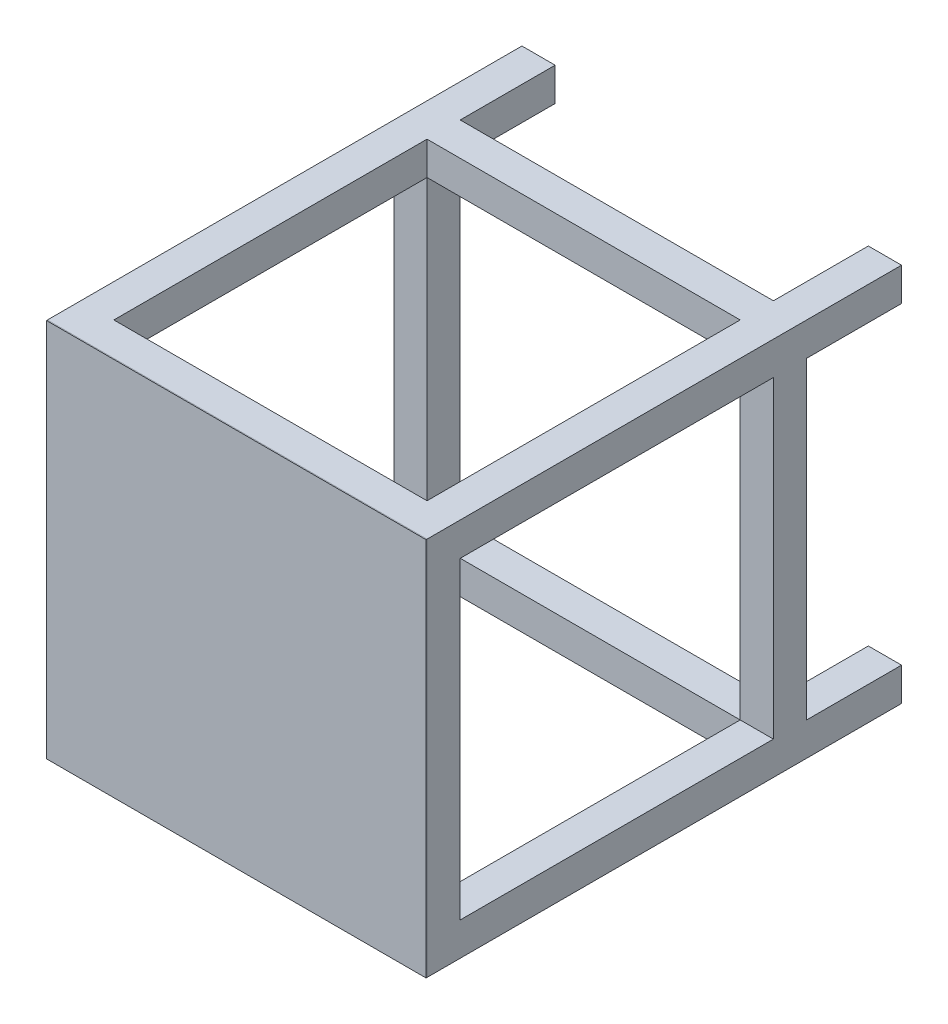
from build123d import *

# Parameters (mm, degrees)
ESQUISSE1_W        = 400
ESQUISSE1_H        = 400
ESQUISSE1_W_2      = 330
ESQUISSE1_H_2      = 330
EXTRU_MINCE1_DEPTH = 35
ESQUISSE2_W        = 35
ESQUISSE2_H        = 35
BOSS_EXTRU_1_DEPTH = 465
ESQUISSE3_W        = 400
ESQUISSE3_H        = 400
BOSS_EXTRU_2_DEPTH = 1
ESQUISSE4_W        = 35
ESQUISSE4_H        = 35
BOSS_EXTRU_3_DEPTH = 330
ESQUISSE5_W        = 35
ESQUISSE5_H        = 35
BOSS_EXTRU_4_DEPTH = 330


with BuildPart() as part:
    # Esquisse1 → Extru.-Mince1 (new body)
    with BuildSketch(Plane.XY):
        with Locations((200, -200)):
            Rectangle(ESQUISSE1_W, ESQUISSE1_H)
        with Locations((200, -200)):
            Rectangle(ESQUISSE1_W_2, ESQUISSE1_H_2, mode=Mode.SUBTRACT)
    extrude(amount=EXTRU_MINCE1_DEPTH)

    # Esquisse2 → Boss.-Extru.1 (add)
    with BuildSketch(Plane(origin=(0, 0, 0), x_dir=(-1, 0, 0), z_dir=(0, 0, -1))):
        with Locations((-382.5, -17.5)):
            Rectangle(ESQUISSE2_W, ESQUISSE2_H)
        with Locations((-17.5, -17.5)):
            Rectangle(ESQUISSE2_W, ESQUISSE2_H)
        with Locations((-17.5, -382.5)):
            Rectangle(ESQUISSE2_W, ESQUISSE2_H)
        with Locations((-382.5, -382.5)):
            Rectangle(ESQUISSE2_W, ESQUISSE2_H)
    extrude(amount=BOSS_EXTRU_1_DEPTH)

    # Esquisse4 → Boss.-Extru.3 (add)
    with BuildSketch(Plane(origin=(35, 0, 0), x_dir=(0, 0, -1), z_dir=(1, 0, 0))):
        with Locations((347.5, -17.5)):
            Rectangle(ESQUISSE4_W, ESQUISSE4_H)
        with Locations((347.5, -382.5)):
            Rectangle(ESQUISSE4_W, ESQUISSE4_H)
    extrude(amount=BOSS_EXTRU_3_DEPTH)

    # Esquisse5 → Boss.-Extru.4 (add)
    with BuildSketch(Plane(origin=(0, -365, 0), x_dir=(1, 0, 0), z_dir=(0, 1, 0))):
        with Locations((17.5, 347.5)):
            Rectangle(ESQUISSE5_W, ESQUISSE5_H)
        with Locations((382.5, 347.5)):
            Rectangle(ESQUISSE5_W, ESQUISSE5_H)
    extrude(amount=BOSS_EXTRU_4_DEPTH)


with BuildPart() as body_2:
    # Esquisse3 → Boss.-Extru.2 (new body)
    with BuildSketch(Plane.XY.offset(35)):
        with Locations((200, -200)):
            Rectangle(ESQUISSE3_W, ESQUISSE3_H)
    extrude(amount=BOSS_EXTRU_2_DEPTH)


solid = Compound([part.part, body_2.part])
